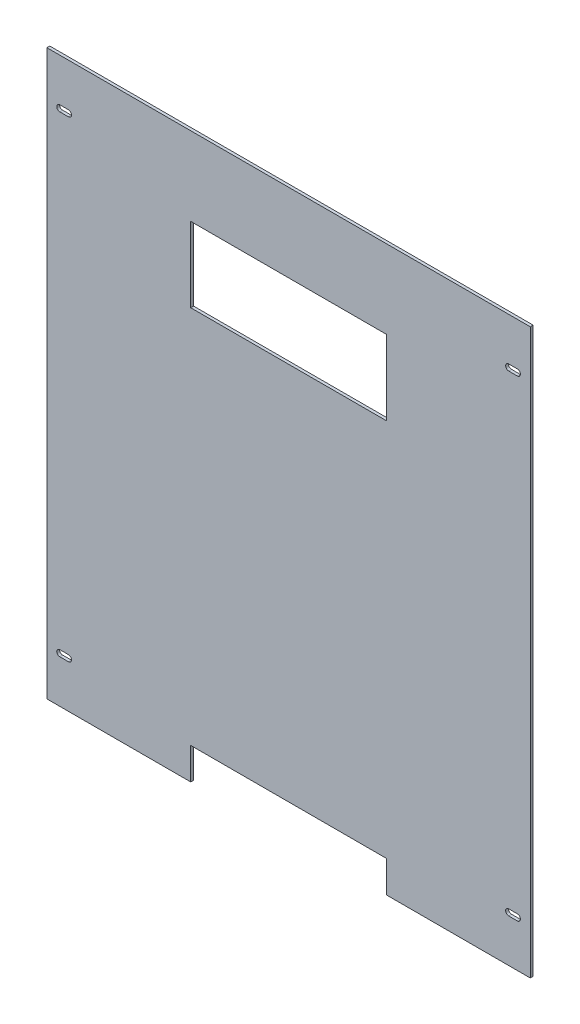
from build123d import *

# Parameters (mm, degrees)
SKETCH1_W            = 533.4
SKETCH1_H            = 622.3
BOSS_EXTRUDE1_DEPTH  = 3.175
CUT_EXTRUDE1_DEPTH   = 820.623651821
LPATTERN1_COUNT      = 2
LPATTERN1_PITCH      = 520.7
LPATTERN1_COUNT_DIR2 = 2
LPATTERN1_PITCH_DIR2 = 495.3
SKETCH5_W            = 215.9
SKETCH5_H            = 82.55
CUT_EXTRUDE3_DEPTH   = 820.623651821
SKETCH6_W            = 215.9
SKETCH6_H            = 34.925
CUT_EXTRUDE4_DEPTH   = 820.623651821


with BuildPart() as part:
    # Sketch1 → Boss-Extrude1 (new body)
    with BuildSketch(Plane.XY):
        with Locations((266.7, 311.15)):
            Rectangle(SKETCH1_W, SKETCH1_H)
    extrude(amount=BOSS_EXTRUDE1_DEPTH)

    # Sketch2 → Cut-Extrude1 (cut, through all)
    with BuildSketch(Plane.XY.offset(3.175)):
        with BuildLine():
            Line((14.2875, 574.8782), (23.8125, 574.8782))
            ThreePointArc((23.8125, 574.8782), (27.1907, 571.5), (23.8125, 568.1218))
            Line((23.8125, 568.1218), (14.2875, 568.1218))
            ThreePointArc((14.2875, 568.1218), (10.9093, 571.5), (14.2875, 574.8782))
        make_face()
    cut_extrude1 = extrude(amount=-CUT_EXTRUDE1_DEPTH, mode=Mode.SUBTRACT)

    # LPattern1: Cut-Extrude1 2 × 2
    with Locations(*[(j * LPATTERN1_PITCH_DIR2, -i * LPATTERN1_PITCH, 0) for i in range(LPATTERN1_COUNT) for j in range(LPATTERN1_COUNT_DIR2) if (i, j) != (0, 0)]):
        add(cut_extrude1, mode=Mode.SUBTRACT)

    # Sketch5 → Cut-Extrude3 (cut, through all)
    with BuildSketch(Plane(origin=(0, 0, 0), x_dir=(-1, 0, 0), z_dir=(0, 0, -1))):
        with Locations((-266.7, 494.422045059)):
            Rectangle(SKETCH5_W, SKETCH5_H)
    extrude(amount=-CUT_EXTRUDE3_DEPTH, mode=Mode.SUBTRACT)

    # Sketch6 → Cut-Extrude4 (cut, through all)
    with BuildSketch(Plane(origin=(0, 0, 0), x_dir=(-1, 0, 0), z_dir=(0, 0, -1))):
        with Locations((-266.7, 17.4625)):
            Rectangle(SKETCH6_W, SKETCH6_H)
    extrude(amount=-CUT_EXTRUDE4_DEPTH, mode=Mode.SUBTRACT)


solid = part.part
